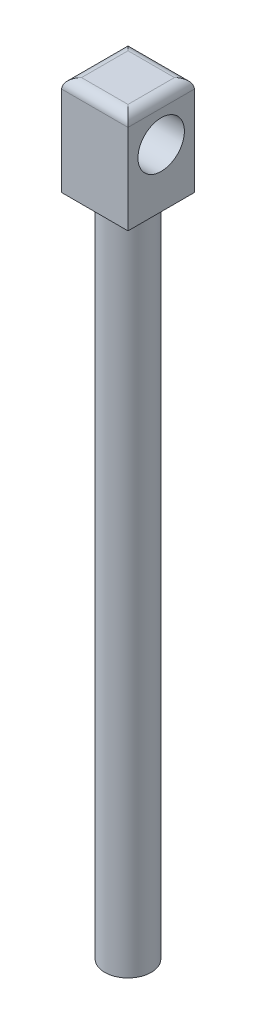
from build123d import *

# Parameters (mm, degrees)
SKETCH1_R           = 17.78
BOSS_EXTRUDE1_DEPTH = 508
SKETCH2_W           = 50.8
SKETCH2_H           = 50.8
BOSS_EXTRUDE2_DEPTH = 76.2
SKETCH4_R           = 17.78
CUT_EXTRUDE1_DEPTH  = 587.954376421
FILLET1_R           = 7.62
SCALE1_SCALE        = 2


with BuildPart() as part:
    # Sketch1 → Boss-Extrude1 (new body)
    with BuildSketch(Plane(origin=(0, 0, 0), x_dir=(1, 0, 0), z_dir=(0, 1, 0))):
        with Locations(Location((0, 0, 0), (0, 0, 270))):
            Circle(SKETCH1_R)
    extrude(amount=BOSS_EXTRUDE1_DEPTH)

    # Sketch2 → Boss-Extrude2 (add)
    with BuildSketch(Plane(origin=(0, 508, 0), x_dir=(1, 0, 0), z_dir=(0, 1, 0))):
        Rectangle(SKETCH2_W, SKETCH2_H)
    extrude(amount=BOSS_EXTRUDE2_DEPTH)

    # Sketch4 → Cut-Extrude1 (cut, through all)
    with BuildSketch(Plane.ZY.offset(25.4)):
        with Locations((0, 552.501368348)):
            Circle(SKETCH4_R)
    extrude(amount=-CUT_EXTRUDE1_DEPTH, mode=Mode.SUBTRACT)

    # Fillet1
    fillet1_edges = [part.edges().sort_by_distance(p)[0] for p in [
        (25.4, 584.2, 0),
        (0, 584.2, -25.4),
        (-25.4, 584.2, 0),
        (0, 584.2, 25.4),
    ]]
    fillet(fillet1_edges, radius=FILLET1_R)


with BuildPart() as part_1:
    # Scale1: scaled about (0, 318.169265299, 0)
    add(part.part.scale(SCALE1_SCALE).moved(Location((0, -318.169265299, 0))))


solid = part_1.part
